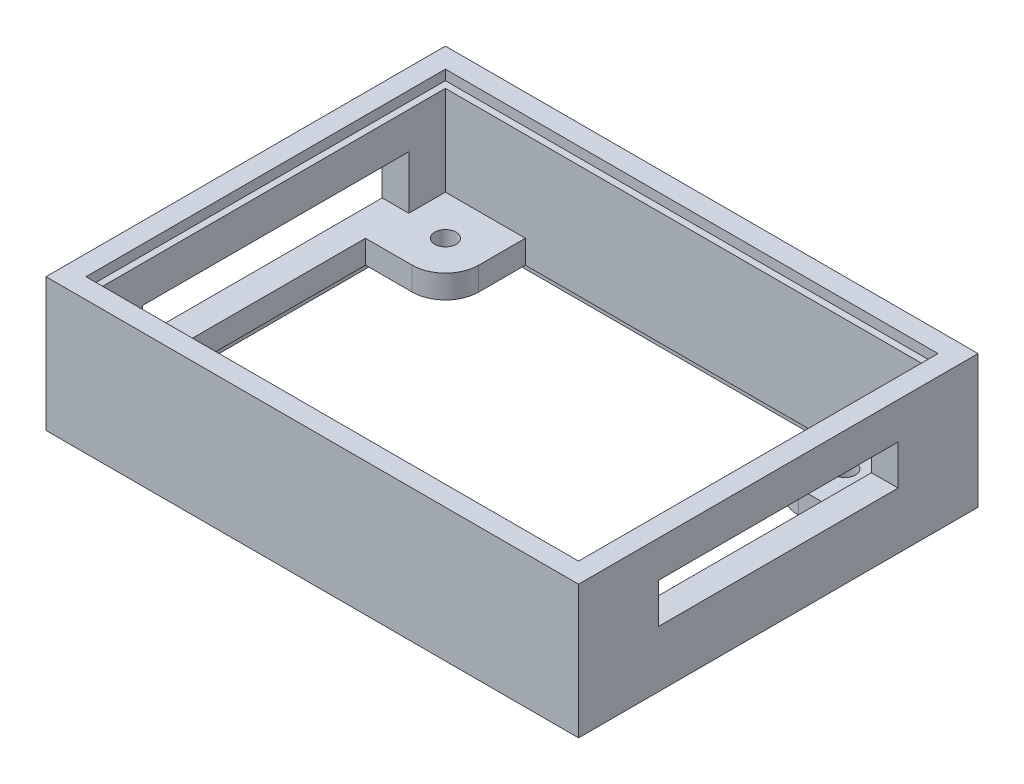
from build123d import *

# Parameters (mm, degrees)
SKETCH_1_W                  = 80
SKETCH_1_H                  = 60
EXTRUDE_1_DEPTH             = 20
SKETCH_2_W                  = 72
SKETCH_2_H                  = 52
CUT_EXTRUDE_1_DEPTH         = 15
CUT_EXTRUDE_2_DEPTH         = 53.201532545
SKETCH_4_R                  = 1.6
CUT_EXTRUDE_3_DEPTH         = 53.201532545
PATTERN_LINEAR_1_COUNT      = 2
PATTERN_LINEAR_1_PITCH      = 60
PATTERN_LINEAR_1_COUNT_DIR2 = 2
PATTERN_LINEAR_1_PITCH_DIR2 = 40
FILLET_1_R                  = 5
SKETCH_5_W                  = 72
SKETCH_5_H                  = 52
CUT_EXTRUDE_4_DEPTH         = 1.5
SKETCH_6_W                  = 40
SKETCH_6_H                  = 8
CUT_EXTRUDE_7_DEPTH         = 85.118963379
SKETCH_7_W                  = 36
SKETCH_7_H                  = 6
CUT_EXTRUDE_8_DEPTH         = 85.118963379
SKETCH_8_W                  = 74
SKETCH_8_H                  = 54
CUT_EXTRUDE_9_DEPTH         = 1.5
SKETCH_9_W                  = 74
SKETCH_9_H                  = 54
CUT_EXTRUDE_10_DEPTH        = 1.5


with BuildPart() as part:
    # 草图1 → 凸台-拉伸1 (new body)
    with BuildSketch(Plane(origin=(0, 0, 0), x_dir=(1, 0, 0), z_dir=(0, 1, 0))):
        Rectangle(SKETCH_1_W, SKETCH_1_H)
    extrude(amount=EXTRUDE_1_DEPTH)

    # 草图2 → 切除-拉伸1 (cut)
    with BuildSketch(Plane(origin=(0, 20, 0), x_dir=(1, 0, 0), z_dir=(0, 1, 0))):
        Rectangle(SKETCH_2_W, SKETCH_2_H)
    extrude(amount=-CUT_EXTRUDE_1_DEPTH, mode=Mode.SUBTRACT)

    # 草图3 → 切除-拉伸2 (cut, through all)
    with BuildSketch(Plane(origin=(0, 5, 0), x_dir=(1, 0, 0), z_dir=(0, 1, 0))):
        Polygon((-24, 14), (-36, 14), (-36, -14), (-24, -14), (-24, -26), (24, -26), (24, -14), (36, -14), (36, 14), (24, 14), (24, 26), (-24, 26), align=None)
    extrude(amount=-CUT_EXTRUDE_2_DEPTH, mode=Mode.SUBTRACT)

    # 草图4 → 切除-拉伸3 (cut, through all)
    with BuildSketch(Plane(origin=(0, 5, 0), x_dir=(1, 0, 0), z_dir=(0, 1, 0))):
        with Locations(Location((-30, 20, 0), (0, 0, 270))):
            Circle(SKETCH_4_R)
    cut_extrude_3 = extrude(amount=-CUT_EXTRUDE_3_DEPTH, mode=Mode.SUBTRACT)

    # 阵列(线性)1: Cut-Extrude 3 2 × 2
    with Locations(*[(i * PATTERN_LINEAR_1_PITCH, 0, j * PATTERN_LINEAR_1_PITCH_DIR2) for i in range(PATTERN_LINEAR_1_COUNT) for j in range(PATTERN_LINEAR_1_COUNT_DIR2) if (i, j) != (0, 0)]):
        add(cut_extrude_3, mode=Mode.SUBTRACT)

    # 圆角1
    fillet_1_edges = [part.edges().sort_by_distance(p)[0] for p in [
        (-24, 2.5, -14),
        (24, 2.5, -14),
        (24, 2.5, 14),
        (-24, 2.5, 14),
    ]]
    fillet(fillet_1_edges, radius=FILLET_1_R)

    # 草图5 → 切除-拉伸4 (cut)
    with BuildSketch(Plane.XZ):
        Rectangle(SKETCH_5_W, SKETCH_5_H)
    extrude(amount=-CUT_EXTRUDE_4_DEPTH, mode=Mode.SUBTRACT)

    # 草图6 → 切除-拉伸7 (cut, through all)
    with BuildSketch(Plane(origin=(-36, 0, 0), x_dir=(0, 0, -1), z_dir=(1, 0, 0))):
        with Locations((0.5, 9)):
            Rectangle(SKETCH_6_W, SKETCH_6_H)
    extrude(amount=-CUT_EXTRUDE_7_DEPTH, mode=Mode.SUBTRACT)

    # 草图7 → 切除-拉伸8 (cut, through all)
    with BuildSketch(Plane.ZY.offset(-36)):
        with Locations((0, 11.5)):
            Rectangle(SKETCH_7_W, SKETCH_7_H)
    extrude(amount=-CUT_EXTRUDE_8_DEPTH, mode=Mode.SUBTRACT)

    # 草图8 → 切除-拉伸9 (cut)
    with BuildSketch(Plane(origin=(0, 20, 0), x_dir=(1, 0, 0), z_dir=(0, 1, 0))):
        Rectangle(SKETCH_8_W, SKETCH_8_H)
    extrude(amount=-CUT_EXTRUDE_9_DEPTH, mode=Mode.SUBTRACT)

    # 草图9 → 切除-拉伸10 (cut)
    with BuildSketch(Plane.XZ):
        Rectangle(SKETCH_9_W, SKETCH_9_H)
    extrude(amount=-CUT_EXTRUDE_10_DEPTH, mode=Mode.SUBTRACT)


solid = part.part
